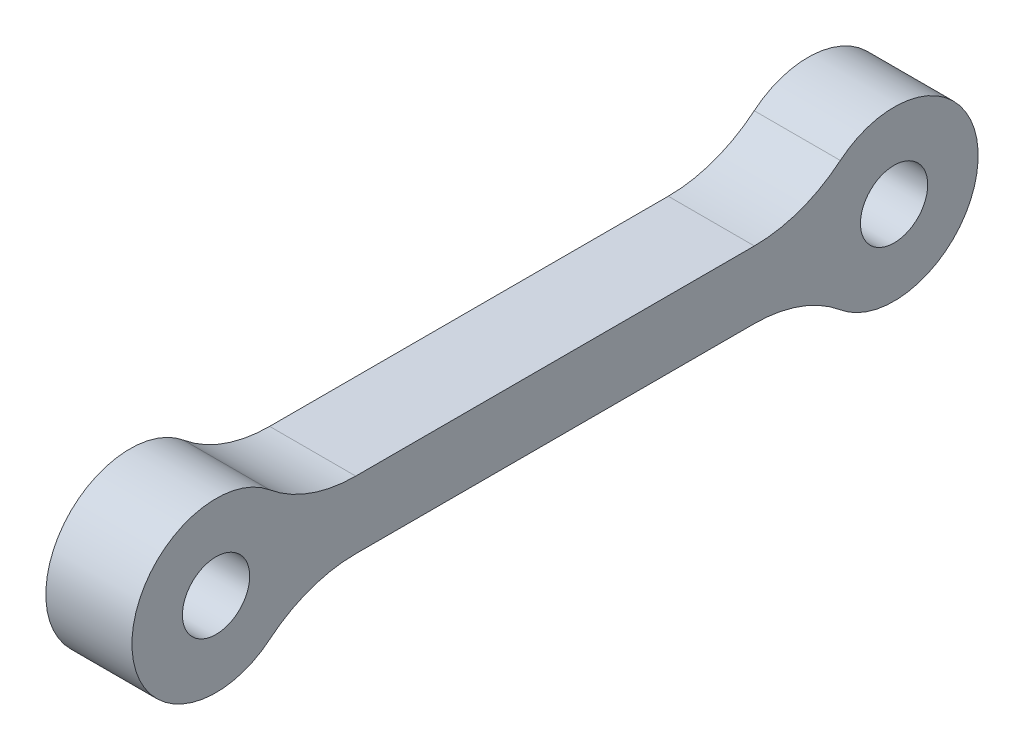
from build123d import *

# Parameters (mm, degrees)
SKETCH1_R           = 1.5875
BOSS_EXTRUDE1_DEPTH = 4.064
FILLET1_R           = 6.35


with BuildPart() as part:
    # Sketch1 → Boss-Extrude1 (new body)
    with BuildSketch(Plane(origin=(0, 0, 0), x_dir=(0, 0, -1), z_dir=(1, 0, 0))):
        with BuildLine():
            Line((3.637419458, 1.5875), (28.362580542, 1.5875))
            ThreePointArc((28.362580542, 1.5875), (35.96875, 0), (28.362580542, -1.5875))
            Line((28.362580542, -1.5875), (3.637419458, -1.5875))
            ThreePointArc((3.637419458, -1.5875), (-3.96875, 0), (3.637419458, 1.5875))
        make_face()
        Circle(SKETCH1_R, mode=Mode.SUBTRACT)
        with Locations((32, 0)):
            Circle(SKETCH1_R, mode=Mode.SUBTRACT)
    extrude(amount=BOSS_EXTRUDE1_DEPTH)

    # Fillet1
    fillet1_edges = [part.edges().sort_by_distance(p)[0] for p in [
        (2.032, 1.5875, -3.637419458),
        (2.032, 1.5875, -28.362580542),
        (2.032, -1.5875, -28.362580542),
        (2.032, -1.5875, -3.637419458),
    ]]
    fillet(fillet1_edges, radius=FILLET1_R)


solid = part.part
